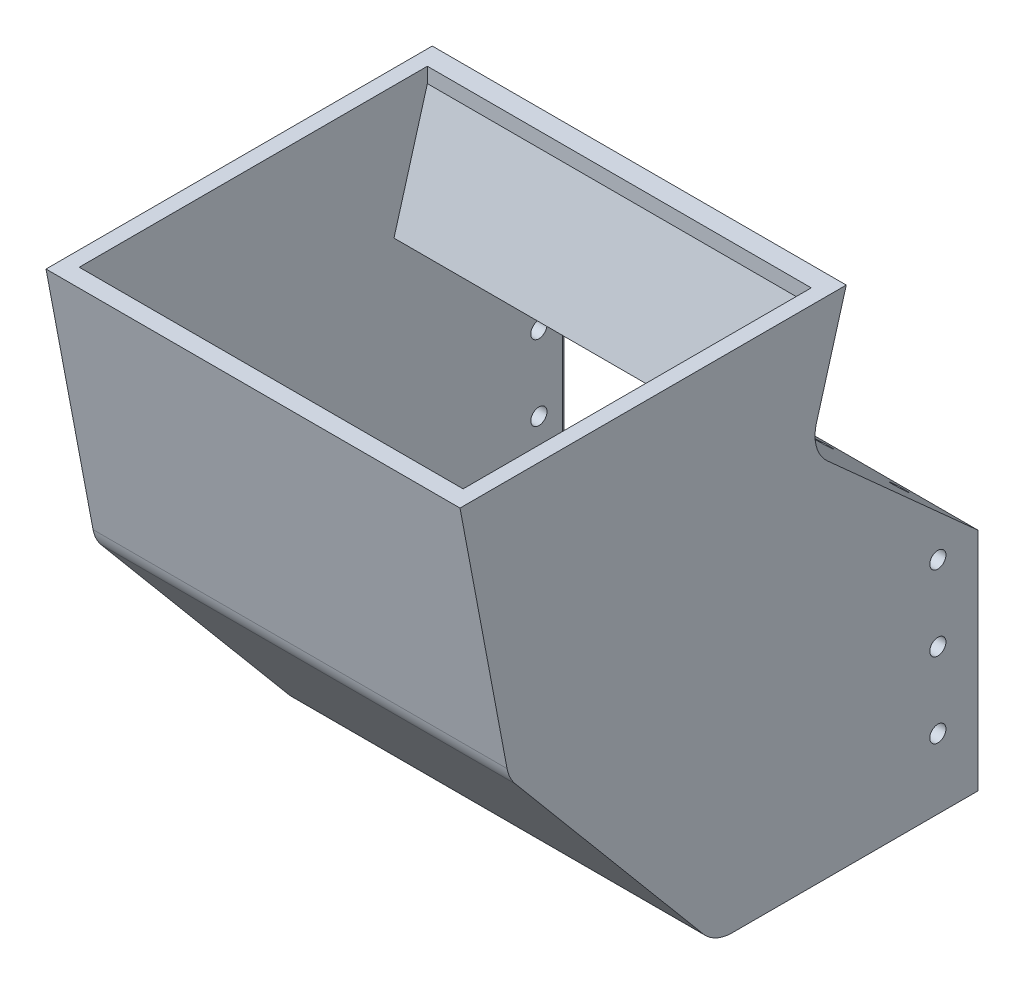
from build123d import *

# Parameters (mm, degrees)
BOSS_EXTRUDE2_DEPTH = 110
CUT_EXTRUDE1_DEPTH  = 102
CUT_EXTRUDE2_START  = -60
CUT_EXTRUDE2_DEPTH  = 60
FILLET1_R           = 10
SKETCH9_R           = 2.15
CUT_EXTRUDE3_DEPTH  = 4
SKETCH10_R          = 2.15
CUT_EXTRUDE4_DEPTH  = 4
CHAMFER1_SIZE       = 2.6
SKETCH12_R          = 2.15
CUT_EXTRUDE5_DEPTH  = 180.904594821


with BuildPart() as part:
    # Sketch3 → Boss-Extrude2 (new body)
    with BuildSketch(Plane(origin=(0, 0, 0), x_dir=(0, 0, -1), z_dir=(1, 0, 0))):
        Polygon((-12.988659511, 68.784407565), (89.636946823, 68.784407565), (80, 34.980398699), (124.636946823, -5.113777665), (124.636946823, -65.113777665), (54.636946823, -65.113777665), (0, 0), align=None)
    extrude(amount=BOSS_EXTRUDE2_DEPTH)

    # Sketch5 → Cut-Extrude1 (cut)
    with BuildSketch(Plane.ZY.offset(-4)):
        Polygon((-84.337245247, 64.784407565), (-84.337245247, 68.784407565), (8.162643706, 68.784407565), (8.162643706, 64.784407565), (-3.736468645, 1.769945376), (-56.502177456, -61.113777665), (-120.636946823, -61.113777665), (-124.636946823, -61.113777665), (-124.636946823, -10.490489494), (-75.468261848, 33.674223088), align=None)
    extrude(amount=-CUT_EXTRUDE1_DEPTH, mode=Mode.SUBTRACT)

    # Sketch8 → Cut-Extrude2 (cut)
    with BuildSketch(Plane.XZ.offset(65.113777665).offset(CUT_EXTRUDE2_START)):
        with BuildLine():
            Line((0, -124.636946823), (110, -124.636946823))
            ThreePointArc((110, -124.636946823), (55, -99.101987445), (0, -124.636946823))
        make_face()
    extrude(amount=CUT_EXTRUDE2_DEPTH, mode=Mode.SUBTRACT)

    # Fillet1
    fillet1_edges = [part.edges().sort_by_distance(p)[0] for p in [
        (55, 34.980398699, -80),
        (55, -65.113777665, -54.636946823),
        (55, 0, 0),
    ]]
    fillet(fillet1_edges, radius=FILLET1_R)

    # Sketch9 → Cut-Extrude3 (cut)
    with BuildSketch(Plane.XZ.offset(65.113777665)):
        with Locations(Location((55, -91.601987445, 0), (0, 0, 270))):
            Circle(SKETCH9_R)
        with Locations(Location((77.397738269, -94.822296043, 0), (0, 0, 270))):
            Circle(SKETCH9_R)
        with Locations(Location((97.980944988, -104.222331585, 0), (0, 0, 270))):
            Circle(SKETCH9_R)
        with Locations((-23.69080463, -159.787957803)):
            Circle(SKETCH9_R)
        with Locations((-17.315743631, -138.076493912)):
            Circle(SKETCH9_R)
        with Locations((-5.082091161, -119.040559097)):
            Circle(SKETCH9_R)
        with Locations(Location((12.019055012, -104.222331585, 0), (0, 0, 270))):
            Circle(SKETCH9_R)
        with Locations(Location((32.602261731, -94.822296043, 0), (0, 0, 270))):
            Circle(SKETCH9_R)
    extrude(amount=-CUT_EXTRUDE3_DEPTH, mode=Mode.SUBTRACT)

    # Sketch10 → Cut-Extrude4 (cut)
    with BuildSketch(Plane(origin=(0, 59.13096402, -53.113115226), x_dir=(1, 0, 0), z_dir=(0, 0.7439491137225913, -0.6682362727294672))):
        with Locations(Location((55, 88.140757853, 0), (0, 0, 270))):
            Circle(SKETCH10_R)
        with Locations(Location((75, 88.140757853, 0), (0, 0, 270))):
            Circle(SKETCH10_R)
        with Locations(Location((95, 88.140757853, 0), (0, 0, 270))):
            Circle(SKETCH10_R)
        with Locations(Location((35, 88.140757853, 0), (0, 0, 270))):
            Circle(SKETCH10_R)
        with Locations(Location((15, 88.140757853, 0), (0, 0, 270))):
            Circle(SKETCH10_R)
    extrude(amount=-CUT_EXTRUDE4_DEPTH, mode=Mode.SUBTRACT)

    # Chamfer1
    chamfer1_edges = [part.edges().sort_by_distance(p)[0] for p in [
        (97.980944988, -61.113777665, -102.072331585),
        (77.397738269, -61.113777665, -92.672296043),
        (12.019055012, -61.113777665, -102.072331585),
        (32.602261731, -61.113777665, -92.672296043),
        (55, -61.113777665, -89.451987445),
    ]]
    chamfer(chamfer1_edges, length=CHAMFER1_SIZE)

    # Sketch12 → Cut-Extrude5 (cut, through all)
    with BuildSketch(Plane(origin=(110, 0, 0), x_dir=(0, 0, -1), z_dir=(1, 0, 0))):
        with Locations((113.968990901, -26.575845979)):
            Circle(SKETCH12_R)
        with Locations((113.968990901, -6.575845979)):
            Circle(SKETCH12_R)
        with Locations((113.968990901, -46.575845979)):
            Circle(SKETCH12_R)
    extrude(amount=-CUT_EXTRUDE5_DEPTH, mode=Mode.SUBTRACT)


solid = part.part
